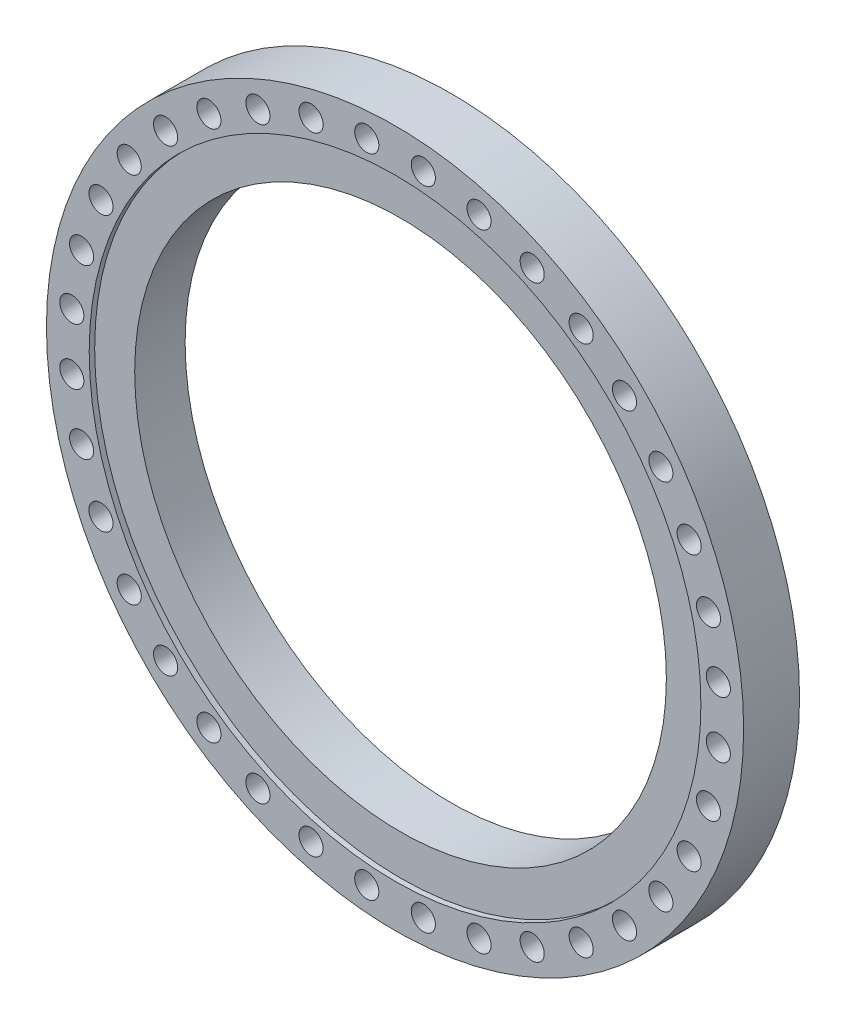
from build123d import *

# Parameters (mm, degrees)
SKETCH10_R         = 11
CUT_EXTRUDE5_DEPTH = 463


with BuildPart() as part:
    # Sketch1 → Revolve3 (revolve)
    with BuildSketch(Plane(origin=(0, 0, 0), x_dir=(0, 0, -1), z_dir=(1, 0, 0)), mode=Mode.PRIVATE) as revolve3_sk:
        Polygon((5, 279), (5, 242.5), (51, 242.5), (51, 318), (0, 318), (0, 279), align=None)
    revolve(revolve3_sk.sketch.rotate(Axis((0, 0, 0), (0, 0, -1)), 90), axis=Axis((0, 0, 0), (0, 0, -1)))

    # Sketch10 → Cut-Extrude5 (cut)
    with BuildSketch(Plane.XY):
        with Locations((-25.798099853, 294.873630635)):
            Circle(SKETCH10_R)
        with Locations((25.798099853, 294.873630635)):
            Circle(SKETCH10_R)
        with Locations((76.61043735, 285.914044582)):
            Circle(SKETCH10_R)
        with Locations((125.095005475, 268.267104963)):
            Circle(SKETCH10_R)
        with Locations((169.77862516, 242.46900511)):
            Circle(SKETCH10_R)
        with Locations((209.303607231, 209.303607231)):
            Circle(SKETCH10_R)
        with Locations((242.46900511, 169.77862516)):
            Circle(SKETCH10_R)
        with Locations((268.267104963, 125.095005475)):
            Circle(SKETCH10_R)
        with Locations((285.914044582, 76.61043735)):
            Circle(SKETCH10_R)
        with Locations((294.873630635, 25.798099853)):
            Circle(SKETCH10_R)
        with Locations((294.873630635, -25.798099853)):
            Circle(SKETCH10_R)
        with Locations((285.914044582, -76.61043735)):
            Circle(SKETCH10_R)
        with Locations((268.267104963, -125.095005475)):
            Circle(SKETCH10_R)
        with Locations((242.46900511, -169.77862516)):
            Circle(SKETCH10_R)
        with Locations((209.303607231, -209.303607231)):
            Circle(SKETCH10_R)
        with Locations((169.77862516, -242.46900511)):
            Circle(SKETCH10_R)
        with Locations((125.095005475, -268.267104963)):
            Circle(SKETCH10_R)
        with Locations((76.61043735, -285.914044582)):
            Circle(SKETCH10_R)
        with Locations((25.798099853, -294.873630635)):
            Circle(SKETCH10_R)
        with Locations((-25.798099853, -294.873630635)):
            Circle(SKETCH10_R)
        with Locations((-76.61043735, -285.914044582)):
            Circle(SKETCH10_R)
        with Locations((-125.095005475, -268.267104963)):
            Circle(SKETCH10_R)
        with Locations((-169.77862516, -242.46900511)):
            Circle(SKETCH10_R)
        with Locations((-209.303607231, -209.303607231)):
            Circle(SKETCH10_R)
        with Locations((-242.46900511, -169.77862516)):
            Circle(SKETCH10_R)
        with Locations((-268.267104963, -125.095005475)):
            Circle(SKETCH10_R)
        with Locations((-285.914044582, -76.61043735)):
            Circle(SKETCH10_R)
        with Locations((-294.873630635, -25.798099853)):
            Circle(SKETCH10_R)
        with Locations((-294.873630635, 25.798099853)):
            Circle(SKETCH10_R)
        with Locations((-285.914044582, 76.61043735)):
            Circle(SKETCH10_R)
        with Locations((-268.267104963, 125.095005475)):
            Circle(SKETCH10_R)
        with Locations((-242.46900511, 169.77862516)):
            Circle(SKETCH10_R)
        with Locations((-209.303607231, 209.303607231)):
            Circle(SKETCH10_R)
        with Locations((-169.77862516, 242.46900511)):
            Circle(SKETCH10_R)
        with Locations((-125.095005475, 268.267104963)):
            Circle(SKETCH10_R)
        with Locations((-76.61043735, 285.914044582)):
            Circle(SKETCH10_R)
    extrude(amount=-CUT_EXTRUDE5_DEPTH, mode=Mode.SUBTRACT)


solid = part.part
